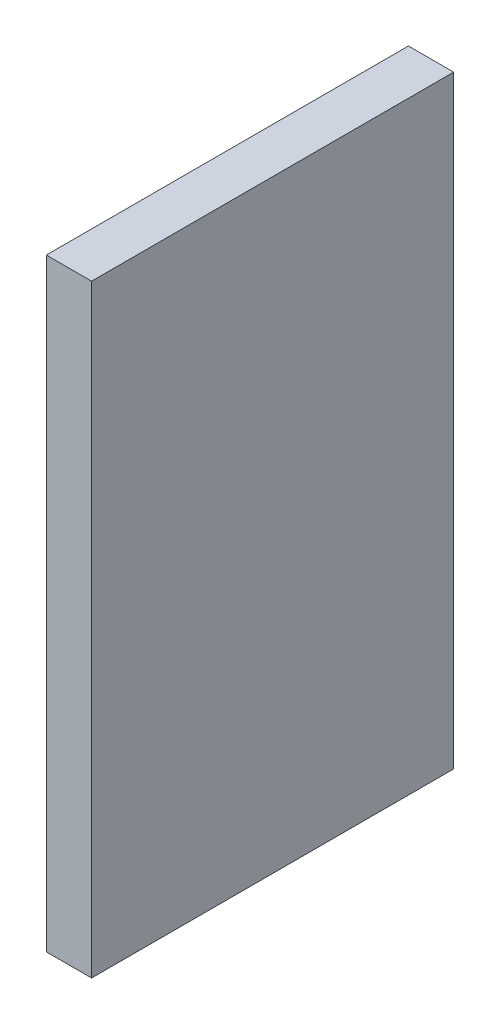
from build123d import *

# Parameters (mm, degrees)
SKETCH1_W           = 200
SKETCH1_H           = 120
BOSS_EXTRUDE1_DEPTH = 15


with BuildPart() as part:
    # Sketch1 → Boss-Extrude1 (new body)
    with BuildSketch(Plane.YZ):
        Rectangle(SKETCH1_W, SKETCH1_H)
    extrude(amount=BOSS_EXTRUDE1_DEPTH)


solid = part.part
